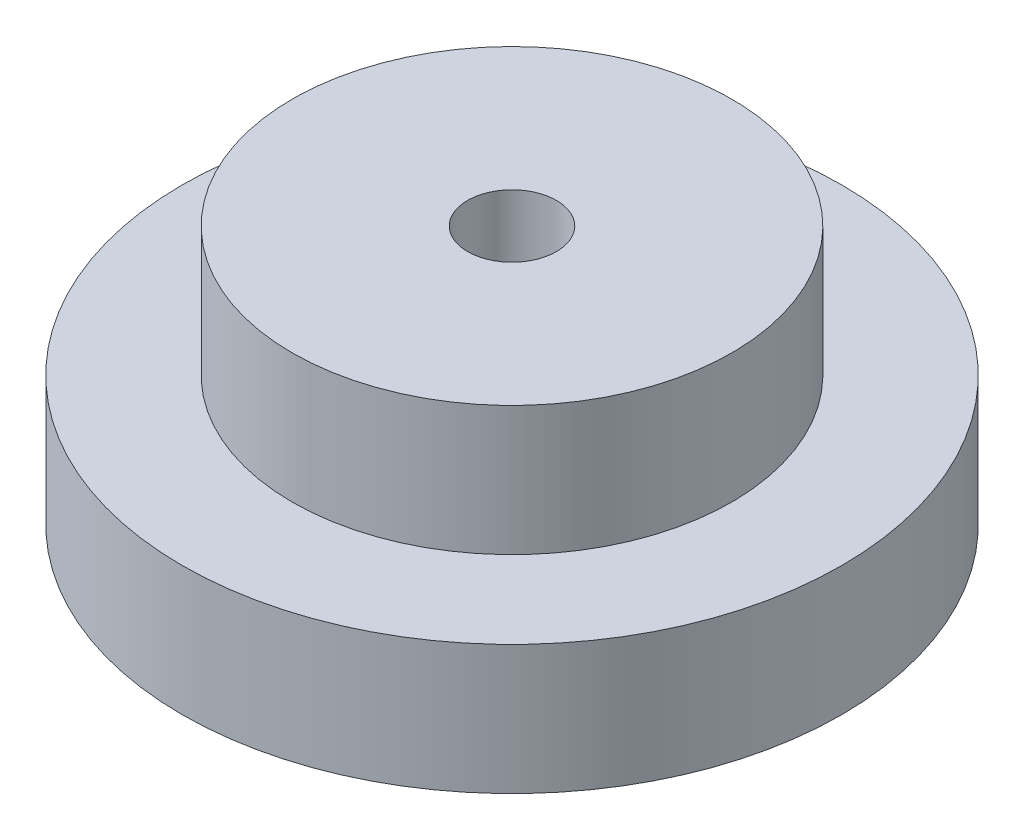
from build123d import *

# Parameters (mm, degrees)
SKETCH1_R           = 14.85
SKETCH1_R_2         = 2
BOSS_EXTRUDE1_DEPTH = 5.82
SKETCH2_R           = 9.9
SKETCH2_R_2         = 2
BOSS_EXTRUDE2_DEPTH = 5.82


with BuildPart() as part:
    # Sketch1 → Boss-Extrude1 (new body)
    with BuildSketch(Plane(origin=(0, 0, 0), x_dir=(1, 0, 0), z_dir=(0, 1, 0))):
        with Locations(Location((0, 0, 0), (0, 0, 270))):
            Circle(SKETCH1_R)
        with Locations(Location((0, 0, 0), (0, 0, 270))):
            Circle(SKETCH1_R_2, mode=Mode.SUBTRACT)
    extrude(amount=BOSS_EXTRUDE1_DEPTH)

    # Sketch2 → Boss-Extrude2 (add)
    with BuildSketch(Plane(origin=(0, 5.82, 0), x_dir=(1, 0, 0), z_dir=(0, 1, 0))):
        with Locations(Location((0, 0, 0), (0, 0, 270))):
            Circle(SKETCH2_R)
        with Locations(Location((0, 0, 0), (0, 0, 270))):
            Circle(SKETCH2_R_2, mode=Mode.SUBTRACT)
    extrude(amount=BOSS_EXTRUDE2_DEPTH)


solid = part.part
